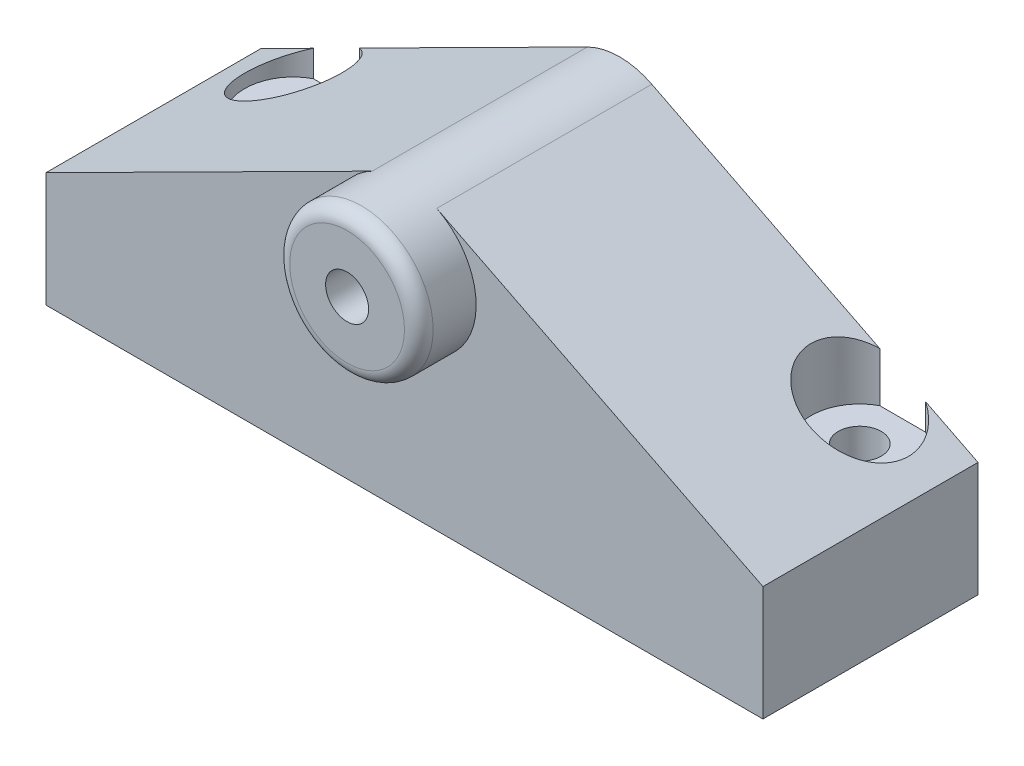
from build123d import *
from build123d.topology import SkipClean

# Parameters (mm, degrees)
SKETCH_1_R          = 1.5
EXTRUDE_1_DEPTH     = 15
SKETCH_2_R          = 5
SKETCH_2_R_2        = 1.5
EXTRUDE_2_DEPTH     = 4
FILLET_1_R          = 1
SKETCH_3_R          = 1.5
CUT_EXTRUDE_1_DEPTH = 19
SKETCH_4_R          = 3.4
CUT_EXTRUDE_3_DEPTH = 19


with BuildPart() as part:
    # 草图1 → 凸台-拉伸1 (new body)
    with BuildSketch(Plane.XY):
        with BuildLine():
            Line((0, 0), (50, 0))
            Line((50, 0), (50, 8))
            Line((50, 8), (27.250210303, 19.465036796))
            ThreePointArc((27.250210303, 19.465036796), (25, 20), (22.749789697, 19.465036796))
            Line((22.749789697, 19.465036796), (0, 8))
            Line((0, 8), (0, 0))
        make_face()
        with Locations((25, 15)):
            Circle(SKETCH_1_R, mode=Mode.SUBTRACT)
    extrude(amount=EXTRUDE_1_DEPTH)

    # 草图2 → 凸台-拉伸2 (add)
    with BuildSketch(Plane.XY.offset(15)):
        with Locations(Location((25, 15, 0), (0, 0, 116.746382546))):
            Circle(SKETCH_2_R)
        with Locations((25, 15)):
            Circle(SKETCH_2_R_2, mode=Mode.SUBTRACT)
    extrude(amount=EXTRUDE_2_DEPTH)

    # 圆角1
    fillet_1_edges = [part.edges().sort_by_distance(p)[0] for p in [
        (27.250210303, 10.534963204, 19),
    ]]
    fillet(fillet_1_edges, radius=FILLET_1_R)

    # 草图3 → 切除-拉伸1 (cut)
    with SkipClean():  # the faces are left unmerged after this step: merging them gives an invalid solid
        with BuildSketch(Plane.XZ):
            with Locations(Location((5.25, 3, 0), (0, 0, 270))):
                Circle(SKETCH_3_R)
            with Locations(Location((44.75, 3, 0), (0, 0, 270))):
                Circle(SKETCH_3_R)
        extrude(amount=-CUT_EXTRUDE_1_DEPTH, mode=Mode.SUBTRACT)

    # 草图4 → 切除-拉伸3 (cut)
    with SkipClean():  # the faces are left unmerged after this step: merging them gives an invalid solid
        with BuildSketch(Plane(origin=(0, 8, 0), x_dir=(-1, 0, 0), z_dir=(0, -1, 0))):
            with Locations((-44.75, -3)):
                Circle(SKETCH_4_R)
            with Locations((-5.25, -3)):
                Circle(SKETCH_4_R)
        extrude(amount=-CUT_EXTRUDE_3_DEPTH, mode=Mode.SUBTRACT)


solid = part.part
